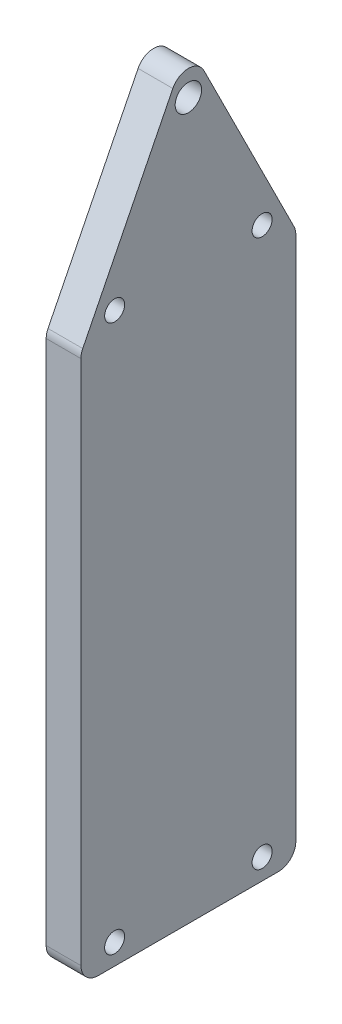
from build123d import *

# Parameters (mm, degrees)
SKETCH1_W           = 39.278818994
SKETCH1_H           = 100
SKETCH1_R           = 1.8288
SKETCH1_R_2         = 2.413
BOSS_EXTRUDE1_DEPTH = 6.35
FILLET1_R           = 3.175


with BuildPart() as part:
    # Sketch1 → Boss-Extrude1 (new body)
    # profile 1 of 2: a face of its own
    with BuildSketch(Plane(origin=(0, 0, 0), x_dir=(0, 0, -1), z_dir=(1, 0, 0))):
        with Locations((0, -53.81)):
            Rectangle(SKETCH1_W, SKETCH1_H)
        with Locations((13.4747, -100)):
            Circle(SKETCH1_R, mode=Mode.SUBTRACT)
        with Locations((-13.4747, -100)):
            Circle(SKETCH1_R, mode=Mode.SUBTRACT)
    # profile 2 of 2: a face of its own
    with BuildSketch(Plane(origin=(0, 0, 0), x_dir=(0, 0, -1), z_dir=(1, 0, 0))):
        Polygon((0, 35.468818994), (19.639409497, -3.81), (-19.639409497, -3.81), align=None)
        with Locations((13.4747, 0)):
            Circle(SKETCH1_R, mode=Mode.SUBTRACT)
        with Locations((0, 26.9494)):
            Circle(SKETCH1_R_2, mode=Mode.SUBTRACT)
        with Locations((-13.4747, 0)):
            Circle(SKETCH1_R, mode=Mode.SUBTRACT)
    extrude(amount=BOSS_EXTRUDE1_DEPTH)

    # Fillet1
    fillet1_edges = [part.edges().sort_by_distance(p)[0] for p in [
        (3.175, -3.81, 19.639409497),
        (3.175, 35.468818994, 0),
        (3.175, -3.81, -19.639409497),
        (3.175, -103.81, -19.639409497),
        (3.175, -103.81, 19.639409497),
    ]]
    fillet(fillet1_edges, radius=FILLET1_R)


solid = part.part
